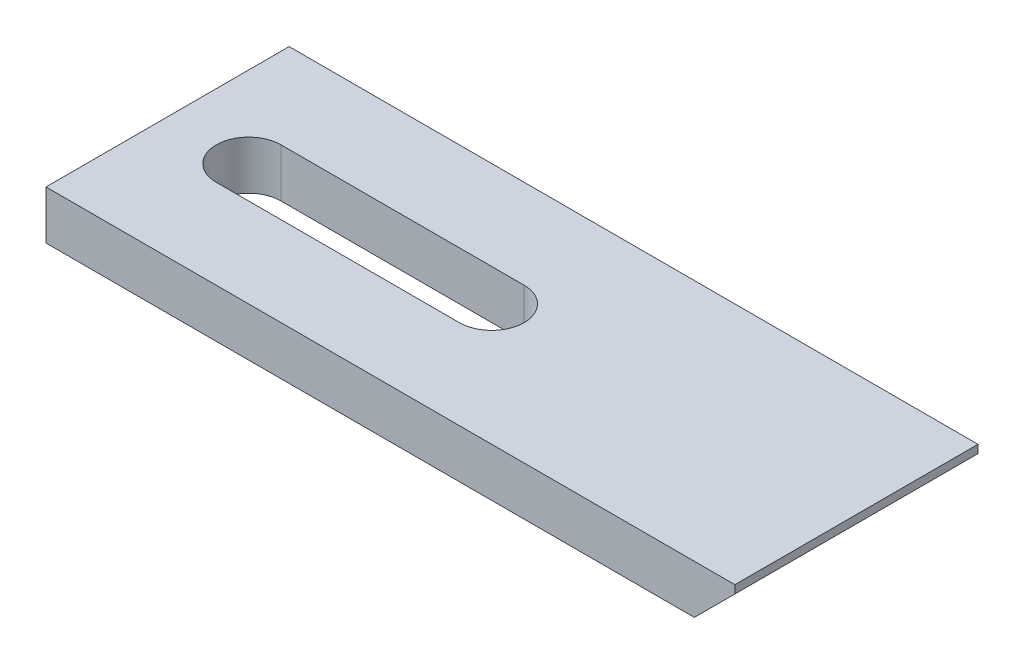
from build123d import *

# Parameters (mm, degrees)
SKETCH_1_W          = 85
SKETCH_1_H          = 30
EXTRUDE_1_DEPTH     = 6
CUT_EXTRUDE_1_DEPTH = 53.366496923
SKETCH_3_W          = 10
SKETCH_3_H          = 8
CUT_EXTRUDE_2_DEPTH = 46.467021015


with BuildPart() as part:
    # Эскиз1 → Бобышка-Вытянуть1 (new body)
    with BuildSketch(Plane(origin=(0, 0, 0), x_dir=(1, 0, 0), z_dir=(0, 1, 0))):
        Rectangle(SKETCH_1_W, SKETCH_1_H)
        with BuildLine():
            Line((-32.5, 4), (-22.5, 4))
            ThreePointArc((-22.5, 4), (-18.5, 0), (-22.5, -4))
            Line((-22.5, -4), (-32.5, -4))
            ThreePointArc((-32.5, -4), (-36.5, 0), (-32.5, 4))
        make_face(mode=Mode.SUBTRACT)
        with BuildLine():
            Line((-2.5, 4), (-12.5, 4))
            ThreePointArc((-12.5, 4), (-16.5, 0), (-12.5, -4))
            Line((-12.5, -4), (-2.5, -4))
            ThreePointArc((-2.5, -4), (1.5, 0), (-2.5, 4))
        make_face(mode=Mode.SUBTRACT)
    extrude(amount=EXTRUDE_1_DEPTH)

    # Эскиз2 → Вырез-Вытянуть1 (cut, through all)
    with BuildSketch(Plane.XY.offset(15)):
        Polygon((42.5, 5), (37.5, 0), (42.5, 0), align=None)
    extrude(amount=-CUT_EXTRUDE_1_DEPTH, mode=Mode.SUBTRACT)

    # Эскиз3 → Вырез-Вытянуть2 (cut, through all)
    with BuildSketch(Plane(origin=(0, 6, 0), x_dir=(1, 0, 0), z_dir=(0, 1, 0))):
        with Locations((-17.5, 0)):
            Rectangle(SKETCH_3_W, SKETCH_3_H)
    extrude(amount=-CUT_EXTRUDE_2_DEPTH, mode=Mode.SUBTRACT)


solid = part.part
